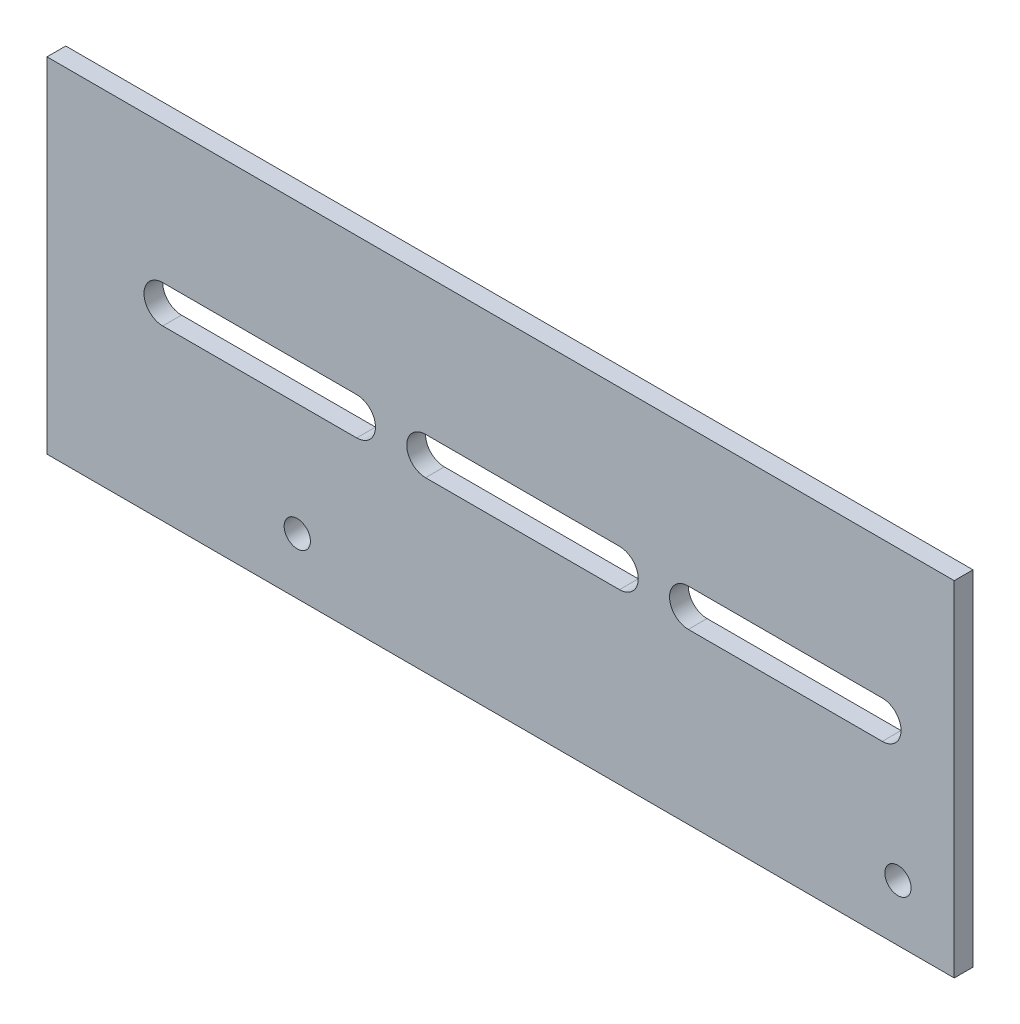
from build123d import *

# Parameters (mm, degrees)
VENTED_LID_RISER_PROFILE_W = 145
VENTED_LID_RISER_PROFILE_H = 55
VENTED_LID_RISER_PROFILE_R = 2.1
VENTED_LID_RISER_DEPTH     = 3


with BuildPart() as part:
    # Vented lid riser profile → Vented lid riser (new body)
    with BuildSketch(Plane.XY):
        with Locations((-18.5, 79.5)):
            Rectangle(VENTED_LID_RISER_PROFILE_W, VENTED_LID_RISER_PROFILE_H)
        with Locations((-51, 61)):
            Circle(VENTED_LID_RISER_PROFILE_R, mode=Mode.SUBTRACT)
        with Locations((45, 61)):
            Circle(VENTED_LID_RISER_PROFILE_R, mode=Mode.SUBTRACT)
        with BuildLine():
            Line((-72.5, 79), (-41.5, 79))
            ThreePointArc((-41.5, 79), (-38.5, 82), (-41.5, 85))
            Line((-41.5, 85), (-72.5, 85))
            ThreePointArc((-72.5, 85), (-75.5, 82), (-72.5, 79))
        make_face(mode=Mode.SUBTRACT)
        with BuildLine():
            Line((-30.5, 79), (0.5, 79))
            ThreePointArc((0.5, 79), (3.5, 82), (0.5, 85))
            Line((0.5, 85), (-30.5, 85))
            ThreePointArc((-30.5, 85), (-33.5, 82), (-30.5, 79))
        make_face(mode=Mode.SUBTRACT)
        with BuildLine():
            Line((11.5, 79), (42.5, 79))
            ThreePointArc((42.5, 79), (45.5, 82), (42.5, 85))
            Line((42.5, 85), (11.5, 85))
            ThreePointArc((11.5, 85), (8.5, 82), (11.5, 79))
        make_face(mode=Mode.SUBTRACT)
    extrude(amount=VENTED_LID_RISER_DEPTH)


solid = part.part
